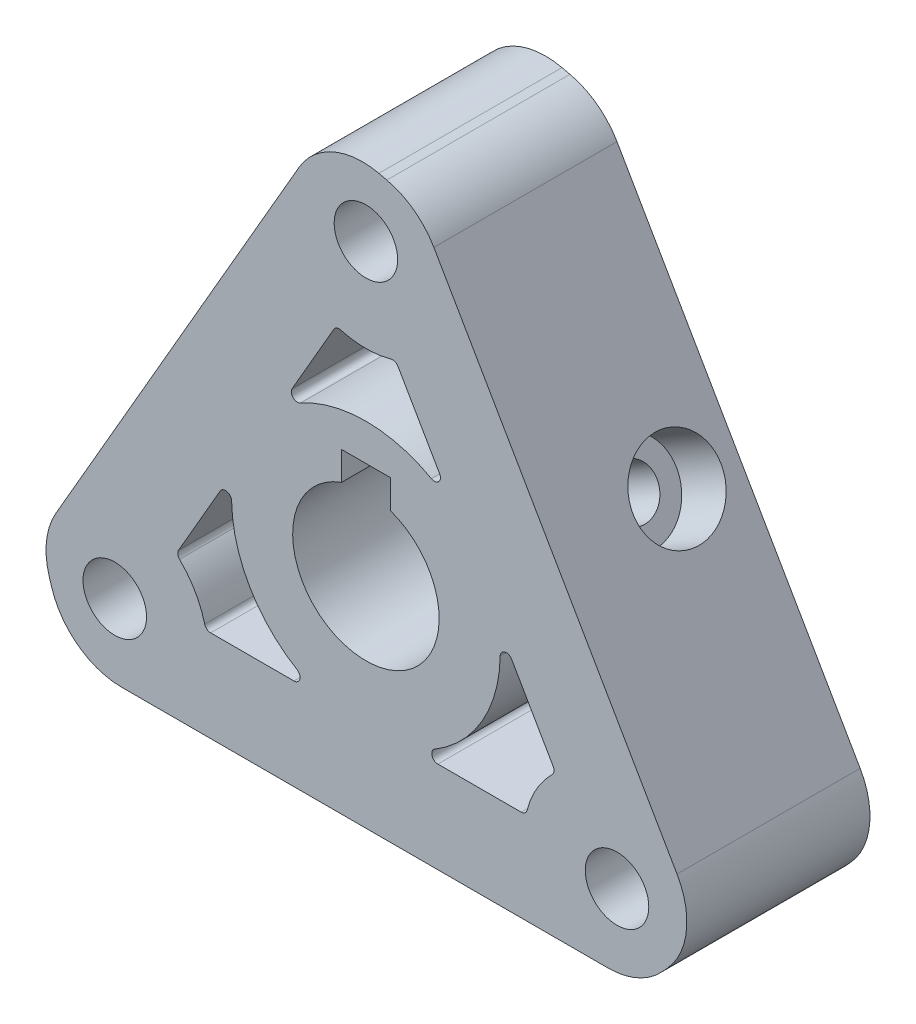
from build123d import *

# Parameters (mm, degrees)
SKETCH_1_R               = 2.6
EXTRUDE_1_DEPTH          = 15
CUT_EXTRUDE_1_REACH      = 58.014
CUT_EXTRUDE_1_END_RADIUS = 6
SKETCH_3_R               = 2
SKETCH_4_R               = 3.6
CUT_EXTRUDE_2_DEPTH      = 4.2
SKETCH_6_R               = 5.1
CUT_EXTRUDE_4_DEPTH      = 6.2
CUT_EXTRUDE_5_REACH      = 53.779
CUT_EXTRUDE_5_END_RADIUS = 6
SKETCH_7_R               = 2
SKETCH_8_R               = 3.6
CUT_EXTRUDE_6_DEPTH      = 4.2
CUT_EXTRUDE_7_DEPTH      = 43.095434039
FILLET_1_R               = 0.5


with BuildPart() as part:
    # ｽｹｯﾁ1 → ﾎﾞｽ - 押し出し1 (new body)
    with BuildSketch(Plane.XY):
        with BuildLine():
            ThreePointArc((1.060449829, 29.107252287), (-2.678502383, 28.760723475), (-5.479274058, 26.259618943))
            Line((-5.479274058, 26.259618943), (-25.394531587, -8.234618943))
            ThreePointArc((-25.394531587, -8.234618943), (-26.160165812, -10.558527256), (-25.934363924, -12.994868595))
            Line((-25.934363924, -12.994868595), (-25.737844829, -13.635249652))
            ThreePointArc((-25.737844829, -13.635249652), (-23.56826597, -16.700012845), (-20.00186007, -17.875))
            Line((-20.00186007, -17.875), (19.828654989, -17.875))
            ThreePointArc((19.828654989, -17.875), (22.224035736, -17.376104532), (24.221068284, -15.962383691))
            Line((24.221068284, -15.962383691), (24.677395, -15.472002635))
            ThreePointArc((24.677395, -15.472002635), (26.246768352, -12.06071063), (25.481134127, -8.384618943))
            Line((25.481134127, -8.384618943), (5.565876598, 26.109618943))
            ThreePointArc((5.565876598, 26.109618943), (3.936130075, 27.934631788), (1.713295639, 28.957252287))
            Line((1.713295639, 28.957252287), (1.060449829, 29.107252287))
        make_face()
        with Locations((-20.56810334, -11.875)):
            Circle(SKETCH_1_R, mode=Mode.SUBTRACT)
        with BuildLine():
            ThreePointArc((6, 0), (-3.464101615, -4.898979486), (-2, 5.656854249))
            Line((-2, 5.656854249), (-2, 8))
            Line((-2, 8), (2, 8))
            Line((2, 8), (2, 5.656854249))
            ThreePointArc((2, 5.656854249), (4.898979486, 3.464101615), (6, 0))
        make_face(mode=Mode.SUBTRACT)
        with Locations((20.56810334, -11.875)):
            Circle(SKETCH_1_R, mode=Mode.SUBTRACT)
        with Locations((0, 23.75)):
            Circle(SKETCH_1_R, mode=Mode.SUBTRACT)
    extrude(amount=EXTRUDE_1_DEPTH)

    # ｶｯﾄ - 押し出し1: up to this cylinder (the profile starts outside it)
    cut_extrude_1_end = Plane(origin=(0, 0, 5), z_dir=(0, 0, -1)) * Cylinder(CUT_EXTRUDE_1_END_RADIUS, 129.028, mode=Mode.PRIVATE)
    # ｽｹｯﾁ3 → ｶｯﾄ - 押し出し1 (cut, up to the surface)
    with BuildSketch(Plane.XZ.offset(17.875), mode=Mode.PRIVATE) as cut_extrude_1_sk1:
        with Locations(Location((0, 5, 0), (0, 0, 270))):
            Circle(SKETCH_3_R)
    cut_extrude_1_tool1 = extrude(cut_extrude_1_sk1.sketch, amount=-CUT_EXTRUDE_1_REACH, mode=Mode.PRIVATE) - cut_extrude_1_end
    add(cut_extrude_1_tool1.solids().sort_by_distance((0, -17.875, 5))[0], mode=Mode.SUBTRACT)

    # ｽｹｯﾁ4 → ｶｯﾄ - 押し出し2 (cut)
    with BuildSketch(Plane.XZ.offset(17.875)):
        with Locations(Location((0, 5, 0), (0, 0, 270))):
            Circle(SKETCH_4_R)
    extrude(amount=-CUT_EXTRUDE_2_DEPTH, mode=Mode.SUBTRACT)

    # ｽｹｯﾁ6 → ｶｯﾄ - 押し出し4 (cut)
    with BuildSketch(Plane(origin=(0, 0, 0), x_dir=(-1, 0, 0), z_dir=(0, 0, -1))):
        with Locations((0, 23.75)):
            Circle(SKETCH_6_R)
        with Locations((-20.56810334, -11.875)):
            Circle(SKETCH_6_R)
        with Locations((20.56810334, -11.875)):
            Circle(SKETCH_6_R)
    extrude(amount=-CUT_EXTRUDE_4_DEPTH, mode=Mode.SUBTRACT)

    # ｶｯﾄ - 押し出し5: up to this cylinder (the profile starts outside it)
    cut_extrude_5_end = Plane(origin=(0, 0, 5), z_dir=(0, 0, -1)) * Cylinder(CUT_EXTRUDE_5_END_RADIUS, 120.558, mode=Mode.PRIVATE)
    # ｽｹｯﾁ7 → ｶｯﾄ - 押し出し5 (cut, up to the surface)
    with BuildSketch(Plane(origin=(15.480204093, 8.9375, 0), x_dir=(0, 0, -1), z_dir=(0.8660254037844386, 0.5000000000000001, 0)), mode=Mode.PRIVATE) as cut_extrude_5_sk1:
        with Locations(Location((-5, 0, 0), (0, 0, 90))):
            Circle(SKETCH_7_R)
    cut_extrude_5_tool1 = extrude(cut_extrude_5_sk1.sketch, amount=-CUT_EXTRUDE_5_REACH, mode=Mode.PRIVATE) - cut_extrude_5_end
    add(cut_extrude_5_tool1.solids().sort_by_distance((15.480204, 8.9375, 5))[0], mode=Mode.SUBTRACT)

    # ｽｹｯﾁ8 → ｶｯﾄ - 押し出し6 (cut)
    with BuildSketch(Plane(origin=(15.480204093, 8.9375, 0), x_dir=(0, 0, -1), z_dir=(0.8660254037844386, 0.5000000000000001, 0))):
        with Locations(Location((-5, 0, 0), (0, 0, 90))):
            Circle(SKETCH_8_R)
    extrude(amount=-CUT_EXTRUDE_6_DEPTH, mode=Mode.SUBTRACT)

    # ｽｹｯﾁ9 → ｶｯﾄ - 押し出し7 (cut, through all)
    with BuildSketch(Plane(origin=(0, 0, 0), x_dir=(-1, 0, 0), z_dir=(0, 0, -1))):
        with BuildLine():
            ThreePointArc((2.426213564, 16.547674838), (0, 16.15), (-2.426213564, 16.547674838))
            Line((-2.426213564, 16.547674838), (-7.157489625, 8.352864316))
            ThreePointArc((-7.157489625, 8.352864316), (0, 11), (7.157489625, 8.352864316))
            Line((7.157489625, 8.352864316), (2.426213564, 16.547674838))
        make_face()
        with BuildLine():
            ThreePointArc((-3.655047879, -10.375), (-9.526279442, -5.5), (-10.812537504, 2.022135684))
            Line((-10.812537504, 2.022135684), (-15.543813565, -6.172674838))
            ThreePointArc((-15.543813565, -6.172674838), (-13.986310271, -8.075), (-13.117600001, -10.375))
            Line((-13.117600001, -10.375), (-3.655047879, -10.375))
        make_face()
        with BuildLine():
            Line((15.543813565, -6.172674838), (10.812537504, 2.022135684))
            ThreePointArc((10.812537504, 2.022135684), (9.526279442, -5.5), (3.655047879, -10.375))
            Line((3.655047879, -10.375), (13.117600001, -10.375))
            ThreePointArc((13.117600001, -10.375), (13.986310271, -8.075), (15.543813565, -6.172674838))
        make_face()
    extrude(amount=-CUT_EXTRUDE_7_DEPTH, mode=Mode.SUBTRACT)

    # ﾌｨﾚｯﾄ1
    fillet_1_edges = [part.edges().sort_by_distance(p)[0] for p in [
        (13.117600001, -10.375, 7.5),
        (15.543813565, -6.172674838, 7.5),
        (10.812537504, 2.022135684, 7.5),
        (3.655047879, -10.375, 7.5),
        (2.426213564, 16.547674838, 7.5),
        (-2.426213564, 16.547674838, 7.5),
        (-7.157489625, 8.352864316, 7.5),
        (7.157489625, 8.352864316, 7.5),
        (-15.543813565, -6.172674838, 7.5),
        (-13.117600001, -10.375, 7.5),
        (-3.655047879, -10.375, 7.5),
        (-10.812537504, 2.022135684, 7.5),
    ]]
    fillet(fillet_1_edges, radius=FILLET_1_R)


solid = part.part
